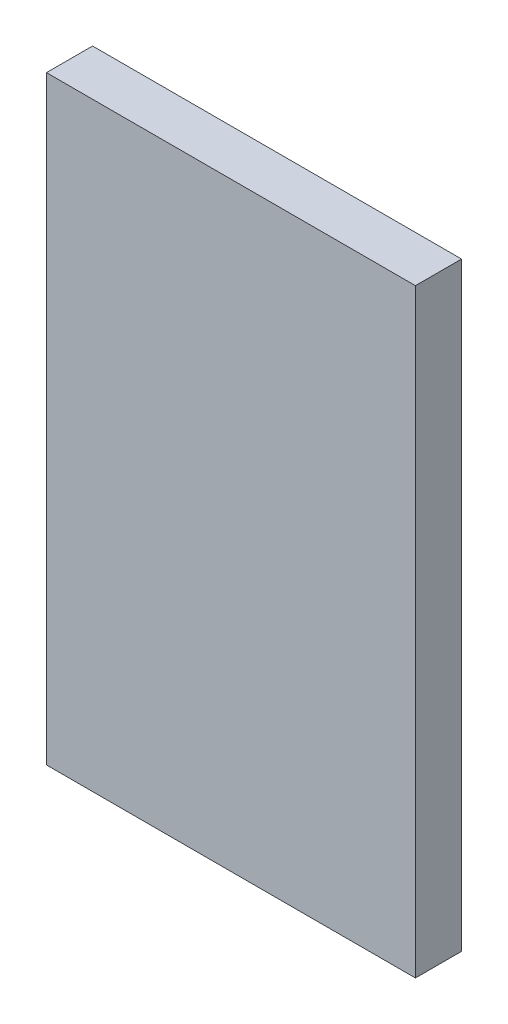
from build123d import *

# Parameters (mm, degrees)
SKETCH1_W           = 20
SKETCH1_H           = 32.5
BOSS_EXTRUDE1_DEPTH = 2.5
SKETCH2_W           = 5
SKETCH2_H           = 7.5
BOSS_EXTRUDE2_DEPTH = 2
FILLET1_R           = 1


with BuildPart() as part:
    # Sketch1 → Boss-Extrude1 (new body)
    with BuildSketch(Plane.XY):
        with Locations((0, 16.25)):
            Rectangle(SKETCH1_W, SKETCH1_H)
    extrude(amount=BOSS_EXTRUDE1_DEPTH)

    # Sketch2 → Boss-Extrude2 (add)
    with BuildSketch(Plane(origin=(0, 0, 0), x_dir=(-1, 0, 0), z_dir=(0, 0, -1))):
        with Locations((0, 3.75)):
            Rectangle(SKETCH2_W, SKETCH2_H)
    extrude(amount=BOSS_EXTRUDE2_DEPTH)

    # Fillet1
    fillet1_edges = [part.edges().sort_by_distance(p)[0] for p in [
        (2.5, 7.5, -1),
        (2.5, 0, -1),
        (-2.5, 0, -1),
        (-2.5, 7.5, -1),
        (2.5, 3.75, -2),
        (0, 0, -2),
        (-2.5, 3.75, -2),
        (0, 7.5, -2),
    ]]
    fillet(fillet1_edges, radius=FILLET1_R)


solid = part.part
